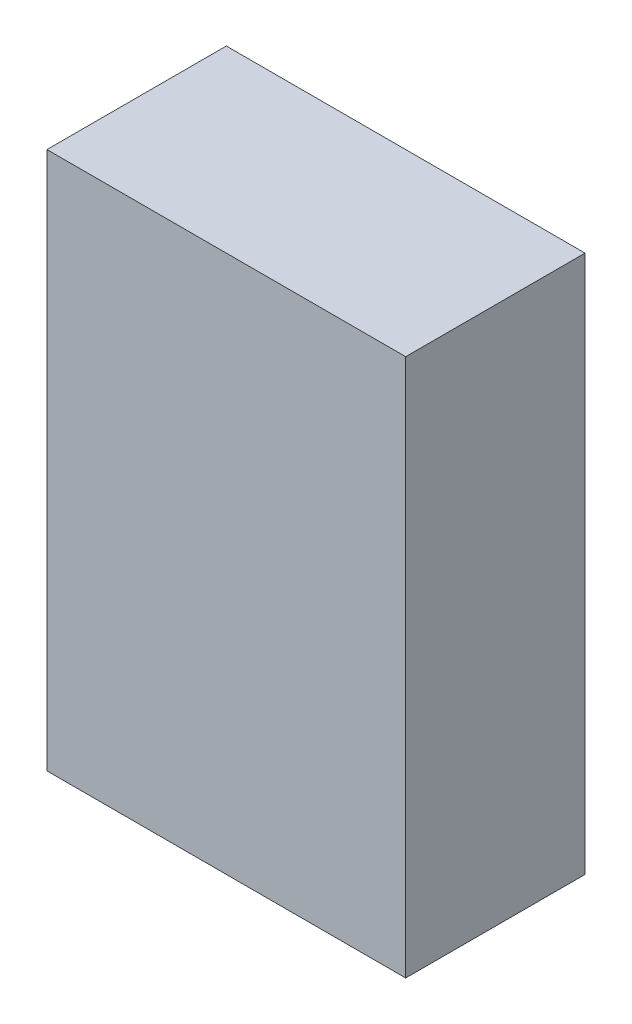
from build123d import *

# Parameters (mm, degrees)
SKETCH1_W           = 4
SKETCH1_H           = 6
BOSS_EXTRUDE1_DEPTH = 2


with BuildPart() as part:
    # Sketch1 → Boss-Extrude1 (new body)
    with BuildSketch(Plane.XY):
        Rectangle(SKETCH1_W, SKETCH1_H)
    extrude(amount=BOSS_EXTRUDE1_DEPTH)


solid = part.part
